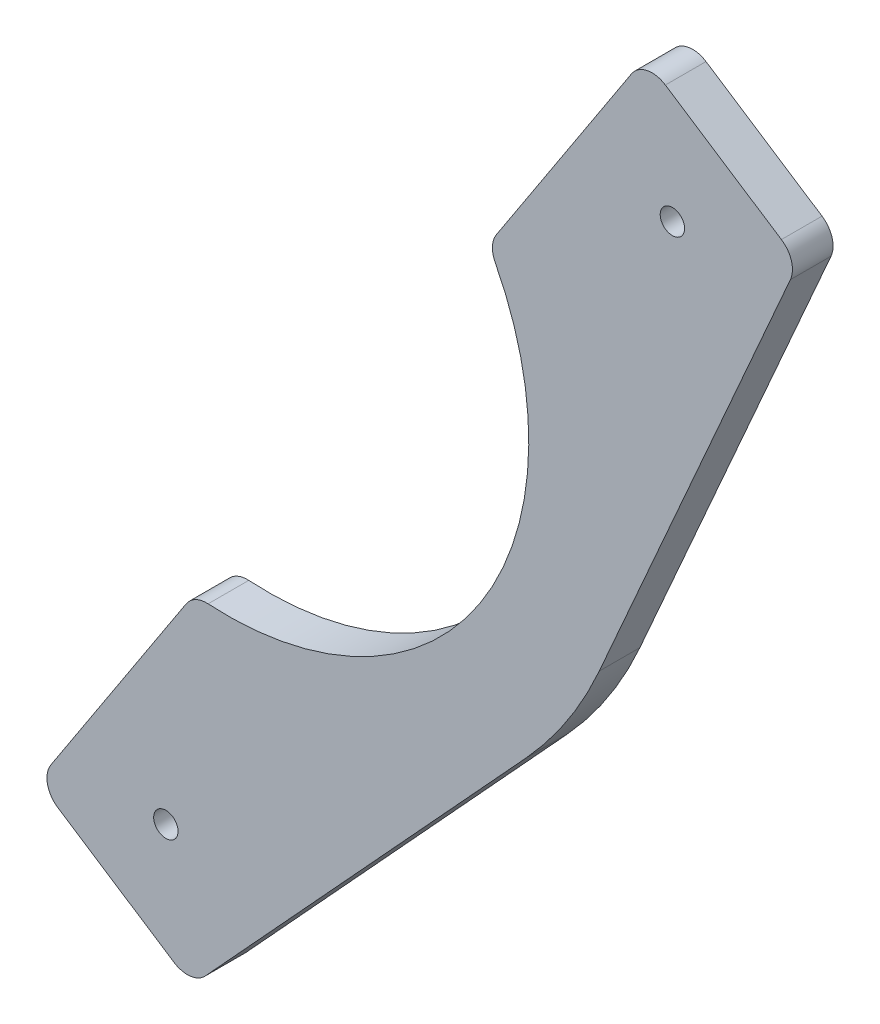
from build123d import *

# Parameters (mm, degrees)
SKETCH1_R           = 1.5
BOSS_EXTRUDE1_DEPTH = 5


with BuildPart() as part:
    # Sketch1 → Boss-Extrude1 (new body)
    # profile 1 of 2: a face of its own
    with BuildSketch(Plane.XY):
        with BuildLine():
            ThreePointArc((-72.013621978, -46.836846361), (-70.000170189, -47.302108237), (-68.163524501, -46.354907448))
            Line((-68.163524501, -46.354907448), (-28.639229463, -3.331157144))
            ThreePointArc((-28.639229463, -3.331157144), (-25.987391066, -0.195217043), (-23.601858593, 3.14777593))
            Line((-23.601858593, 3.14777593), (-34.401340039, 10.203355318))
            ThreePointArc((-34.401340039, 10.203355318), (-48.850216004, -2.67902279), (-67.821167684, -6.529824621))
            ThreePointArc((-67.821167684, -6.529824621), (-69.355206904, -6.841210213), (-70.523579623, -7.882911947))
            Line((-70.523579623, -7.882911947), (-87.164902157, -33.35461938))
            ThreePointArc((-87.164902157, -33.35461938), (-87.589542424, -35.611111919), (-86.29422726, -37.506959108))
            Line((-86.29422726, -37.506959108), (-72.013621978, -46.836846361))
        make_face()
        with Locations((-73.020492871, -32.63009114)):
            Circle(SKETCH1_R, mode=Mode.SUBTRACT)
    # profile 2 of 2: a face of its own
    with BuildSketch(Plane.XY):
        with BuildLine():
            Line((-34.401340039, 10.203355318), (-23.601858593, 3.14777593))
            ThreePointArc((-23.601858593, 3.14777593), (-21.49872615, 6.675268117), (-19.692182619, 10.363461126))
            Line((-19.692182619, 10.363461126), (3.830578313, 63.841425809))
            ThreePointArc((3.830578313, 63.841425809), (3.960207556, 65.903864408), (2.725322858, 67.560824426))
            Line((2.725322858, 67.560824426), (-11.555282424, 76.890711678))
            ThreePointArc((-11.555282424, 76.890711678), (-13.811774964, 77.315351945), (-15.707622153, 76.020036781))
            Line((-15.707622153, 76.020036781), (-32.348944687, 50.548329348))
            ThreePointArc((-32.348944687, 50.548329348), (-32.833563081, 49.059913302), (-32.502490474, 47.530002114))
            ThreePointArc((-32.502490474, 47.530002114), (-28.408225903, 28.610100423), (-34.401340039, 10.203355318))
        make_face()
        with Locations((-10.689254116, 62.775972546)):
            Circle(SKETCH1_R, mode=Mode.SUBTRACT)
    extrude(amount=BOSS_EXTRUDE1_DEPTH)


solid = part.part
